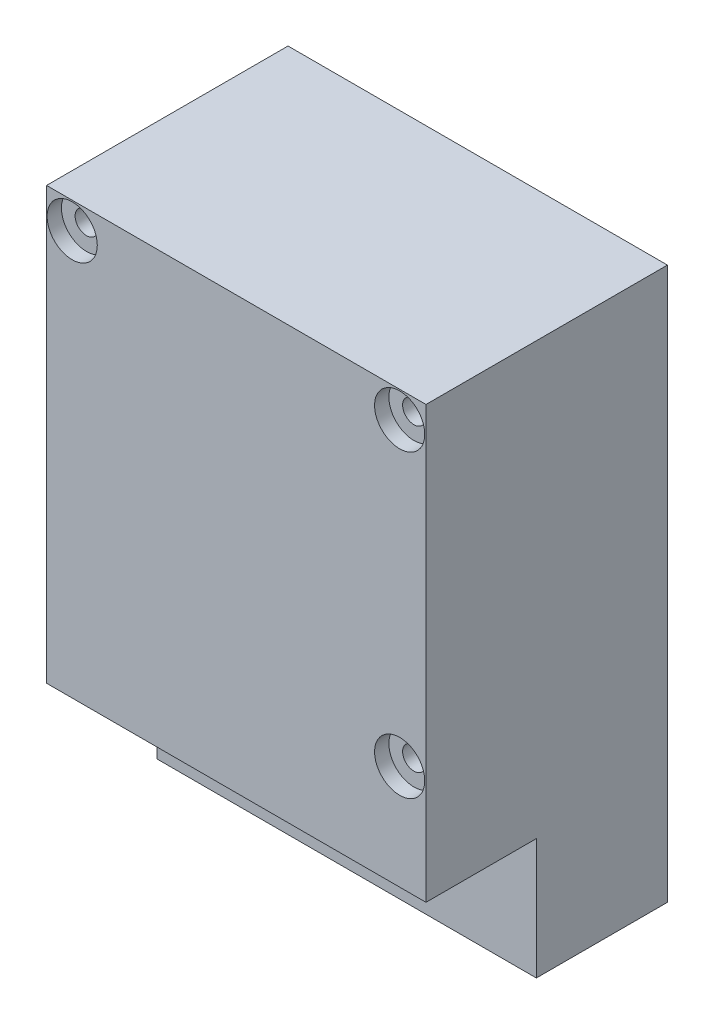
from build123d import *

# Parameters (mm, degrees)
SKETCH_1_W                   = 110
SKETCH_1_H                   = 160
EXTRUDE_1_DEPTH              = 70
SKETCH_2_W                   = 110
SKETCH_2_H                   = 20
CUT_EXTRUDE_1_DEPTH          = 35
SKETCH_9_W                   = 110
SKETCH_9_H                   = 12
CUT_EXTRUDE_2_DEPTH          = 35
HOLE_WIZARD_M6_1_D           = 6.6
HOLE_WIZARD_M6_1_CBORE_D     = 14.55
HOLE_WIZARD_M6_1_CBORE_DEPTH = 4.15


with BuildPart() as part:
    # 草图1 → 凸台-拉伸1 (new body)
    with BuildSketch(Plane.XY):
        Rectangle(SKETCH_1_W, SKETCH_1_H)
    extrude(amount=EXTRUDE_1_DEPTH)

    # 草图2 → 切除-拉伸1 (cut)
    with BuildSketch(Plane.XZ.offset(80)):
        with Locations((0, 60)):
            Rectangle(SKETCH_2_W, SKETCH_2_H)
    extrude(amount=-CUT_EXTRUDE_1_DEPTH, mode=Mode.SUBTRACT)

    # 草图9 → 切除-拉伸2 (cut)
    with BuildSketch(Plane.XZ.offset(80)):
        with Locations((0, 44)):
            Rectangle(SKETCH_9_W, SKETCH_9_H)
    extrude(amount=-CUT_EXTRUDE_2_DEPTH, mode=Mode.SUBTRACT)

    # M6 六角头螺钉的柱形沉头孔1 (through all)
    with Locations(Plane.XY.offset(70)):
        with Locations((-47.570659981, 72.32370147), (47.366931244, 72.32370147), (47.366931244, -14.668469031)):
            CounterBoreHole(HOLE_WIZARD_M6_1_D / 2, HOLE_WIZARD_M6_1_CBORE_D / 2, HOLE_WIZARD_M6_1_CBORE_DEPTH)


solid = part.part
